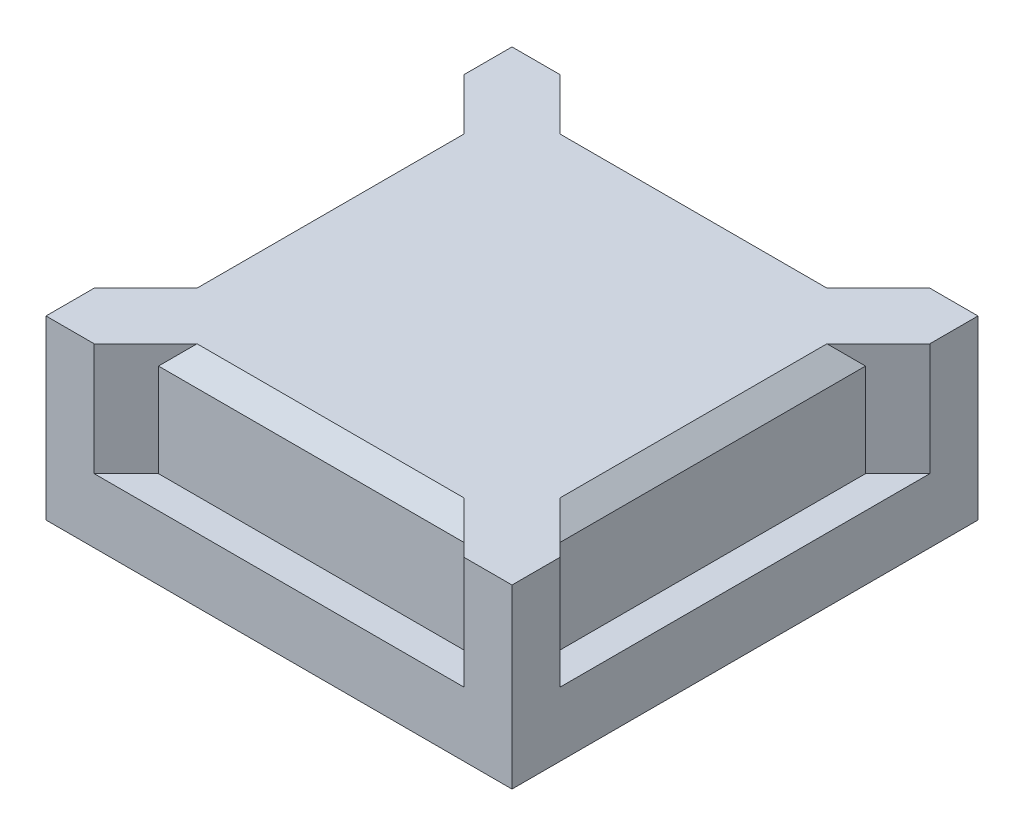
from build123d import *

# Parameters (mm, degrees)
SKETCH_1_W          = 5.8
SKETCH_1_H          = 5.8
EXTRUDE_1_DEPTH     = 2.2
SKETCH_3_W          = 3.7
SKETCH_3_H          = 3
CUT_EXTRUDE_2_DEPTH = 1.75
CUT_EXTRUDE_START   = -0.8
CUT_EXTRUDE_1_DEPTH = 4.854030511
CHAMFER_1_SIZE      = 0.24


with BuildPart() as part:
    # 草图1 → 凸台-拉伸1 (new body)
    with BuildSketch(Plane(origin=(0, 0, 0), x_dir=(1, 0, 0), z_dir=(0, 1, 0))):
        Rectangle(SKETCH_1_W, SKETCH_1_H)
    extrude(amount=EXTRUDE_1_DEPTH)

    # 草图3 → 切除-拉伸2 (cut)
    with BuildSketch(Plane.XZ):
        Rectangle(SKETCH_3_W, SKETCH_3_H)
    extrude(amount=-CUT_EXTRUDE_2_DEPTH, mode=Mode.SUBTRACT)

    # 草图2 → 切除-拉伸1 (cut, through all)
    with BuildSketch(Plane.XZ.offset(CUT_EXTRUDE_START)):
        Polygon((-2.9, 2.3), (-2.9, -2.3), (-2.5, -1.9), (-2.5, 1.9), align=None)
        Polygon((-1.9, 2.5), (-2.3, 2.9), (2.3, 2.9), (1.9, 2.5), align=None)
        Polygon((2.5, 1.9), (2.9, 2.3), (2.9, -2.3), (2.5, -1.9), align=None)
        Polygon((1.9, -2.5), (2.3, -2.9), (-2.3, -2.9), (-1.9, -2.5), align=None)
    extrude(amount=-CUT_EXTRUDE_1_DEPTH, mode=Mode.SUBTRACT)

    # 倒角1
    chamfer_1_edges = [part.edges().sort_by_distance(p)[0] for p in [
        (-2.5, 2.2, 0),
        (0, 2.2, 2.5),
        (2.5, 2.2, 0),
        (0, 2.2, -2.5),
    ]]
    chamfer(chamfer_1_edges, length=CHAMFER_1_SIZE)


solid = part.part
